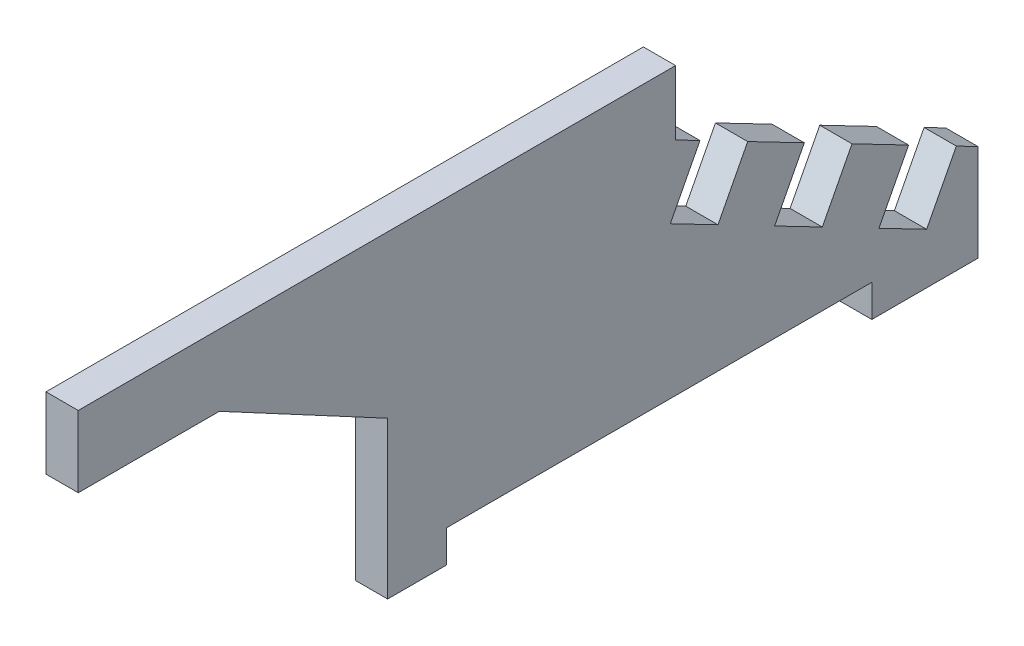
from build123d import *

# Parameters (mm, degrees)
BOSS_EXTRUDE1_DEPTH = 3


with BuildPart() as part:
    # Sketch1 → Boss-Extrude1 (new body)
    with BuildSketch(Plane(origin=(0, 0, 0), x_dir=(0, 0, -1), z_dir=(1, 0, 0))):
        Polygon((-23.405592815, -13.328738611), (32.192831055, -13.328738611), (32.192831055, -19.328738611), (34.462282484, -20.506092894), (31.699266712, -25.832042935), (36.137558413, -28.134556078), (38.900574185, -22.808606037), (44.171084966, -25.542860827), (41.408069194, -30.868810868), (45.846360891, -33.17132401), (48.609376663, -27.845373968), (53.879887443, -30.579628758), (51.116871671, -35.9055788), (55.555163369, -38.208091941), (58.318179141, -32.8821419), (60.336210887, -33.929063763), (60.336210887, -39.929063763), (60.336210887, -42.929063763), (50.45453087, -42.929063763), (50.45453087, -39.929063763), (10.850026953, -39.929063763), (10.850026953, -42.929063763), (5.387336757, -42.929063763), (5.387336757, -39.929063763), (5.387336757, -28.352747539), (-10.278235861, -19.965608879), (-23.405592815, -19.965608879), align=None)
    extrude(amount=BOSS_EXTRUDE1_DEPTH)


solid = part.part
